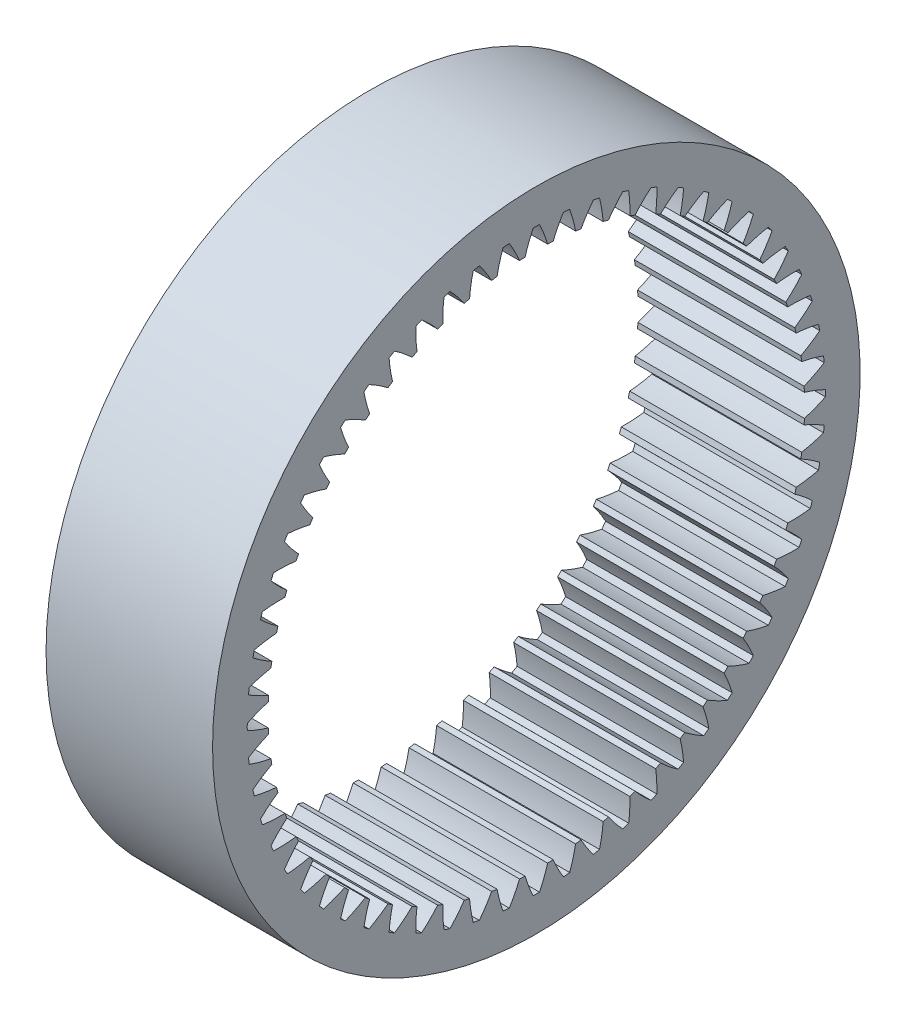
from build123d import *

# Parameters (mm, degrees)
BASPROSKE_W     = 18
BASPROSKE_H     = 6
TOOTHCUT_DEPTH  = 53.668776329
TEETHCUTS_COUNT = 60
TEETHCUTS_ANGLE = 354


with BuildPart() as part:
    # BasProSke → Base-Revolve (revolve)
    with BuildSketch(Plane(origin=(0, 0, 0), x_dir=(1, 0, 0), z_dir=(0, 1, 0)), mode=Mode.PRIVATE) as base_revolve_sk:
        with Locations((9, 32)):
            Rectangle(BASPROSKE_W, BASPROSKE_H)
    revolve(base_revolve_sk.sketch.rotate(Axis((-10, 0, 0), (1, 0, 0)), 180), axis=Axis((-10, 0, 0), (1, 0, 0)))

    # TooCutSke → ToothCut (cut, through all)
    with BuildSketch(Plane(origin=(0, 0, 0), x_dir=(0, 0, -1), z_dir=(1, 0, 0))):
        with BuildLine():
            ThreePointArc((1.227357706, 28.948593027), (0.830805794, 30.117149174), (0.339543276, 31.24915537))
            ThreePointArc((0.339543276, 31.24915537), (0, 31.251), (-0.339543276, 31.24915537))
            ThreePointArc((-0.339543276, 31.24915537), (-0.830805794, 30.117149174), (-1.227357706, 28.948593027))
            ThreePointArc((-1.227357706, 28.948593027), (0, 28.9746), (1.227357706, 28.948593027))
        make_face()
    toothcut = extrude(amount=TOOTHCUT_DEPTH, mode=Mode.SUBTRACT)

    # TeethCuts: ToothCut ×60 about axis
    teethcuts_axis = Axis((-10, 0, 0), (1, 0, 0))
    for i in range(1, TEETHCUTS_COUNT):
        add(toothcut.rotate(teethcuts_axis, i * TEETHCUTS_ANGLE / (TEETHCUTS_COUNT - 1)), mode=Mode.SUBTRACT)


solid = part.part
